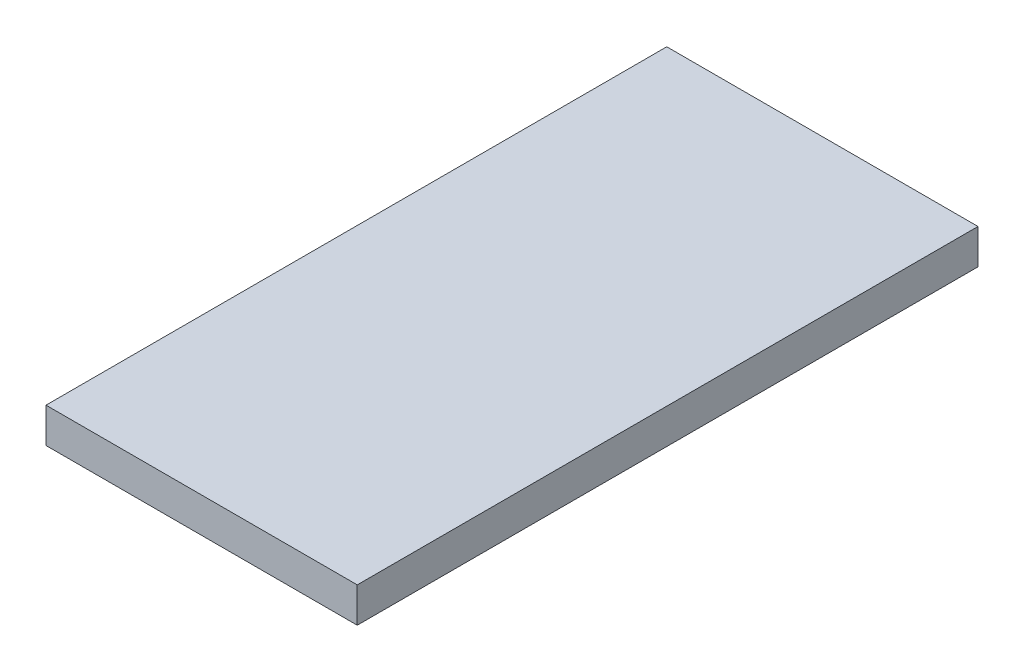
from build123d import *

# Parameters (mm, degrees)
SKETCH1_W           = 17.8
SKETCH1_H           = 35.5
BOSS_EXTRUDE1_DEPTH = 2


with BuildPart() as part:
    # Sketch1 → Boss-Extrude1 (new body)
    with BuildSketch(Plane(origin=(0, 0, 0), x_dir=(1, 0, 0), z_dir=(0, 1, 0))):
        Rectangle(SKETCH1_W, SKETCH1_H)
    extrude(amount=BOSS_EXTRUDE1_DEPTH)


solid = part.part
